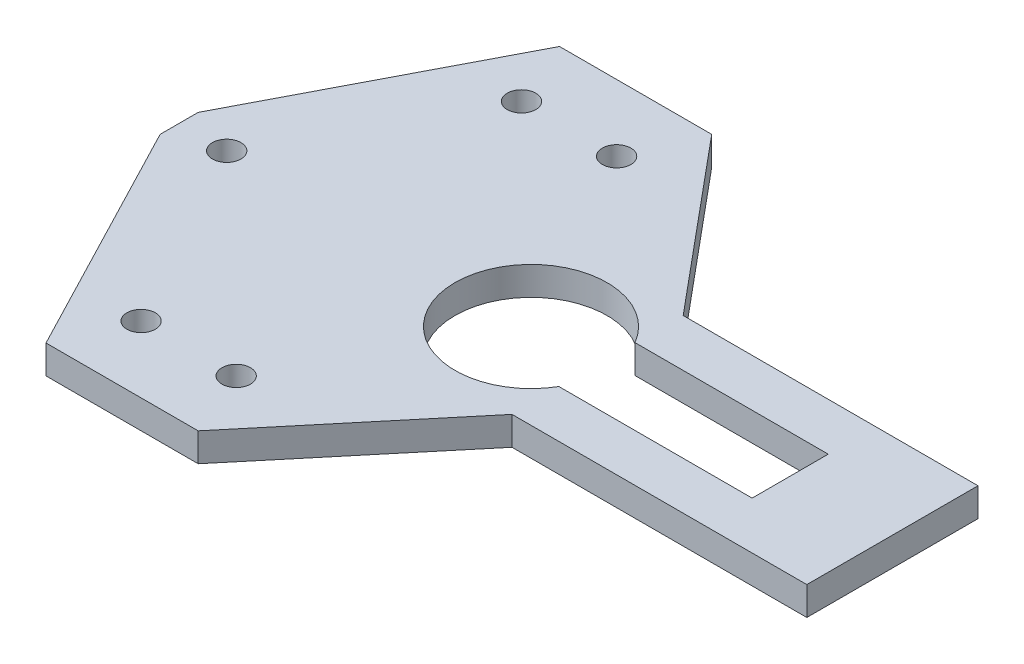
from build123d import *

# Parameters (mm, degrees)
SKETCH_1_R      = 1.5
EXTRUDE_1_DEPTH = 3


with BuildPart() as part:
    # 草图1 → 凸台-拉伸1 (new body)
    with BuildSketch(Plane(origin=(0, 0, 0), x_dir=(1, 0, 0), z_dir=(0, 1, 0))):
        Polygon((38, -9), (38, 9), (7, 9), (-8, 27), (-24, 27), (-37, 2), (-37, -2), (-24, -27), (-8, -27), (7, -9), align=None)
        with Locations(Location((-21, 20, 0), (0, 0, 270))):
            Circle(SKETCH_1_R, mode=Mode.SUBTRACT)
        with Locations(Location((-11, 20, 0), (0, 0, 270))):
            Circle(SKETCH_1_R, mode=Mode.SUBTRACT)
        with Locations(Location((-11, -20, 0), (0, 0, 90))):
            Circle(SKETCH_1_R, mode=Mode.SUBTRACT)
        with Locations(Location((-21, -20, 0), (0, 0, 90))):
            Circle(SKETCH_1_R, mode=Mode.SUBTRACT)
        with Locations(Location((-32, 0, 0), (0, 0, 270))):
            Circle(SKETCH_1_R, mode=Mode.SUBTRACT)
        with BuildLine():
            Line((6.92820323, 4), (27.25, 4))
            Line((27.25, 4), (27.25, -4))
            Line((27.25, -4), (6.92820323, -4))
            ThreePointArc((6.92820323, -4), (-8, 0), (6.92820323, 4))
        make_face(mode=Mode.SUBTRACT)
    extrude(amount=EXTRUDE_1_DEPTH)


solid = part.part
